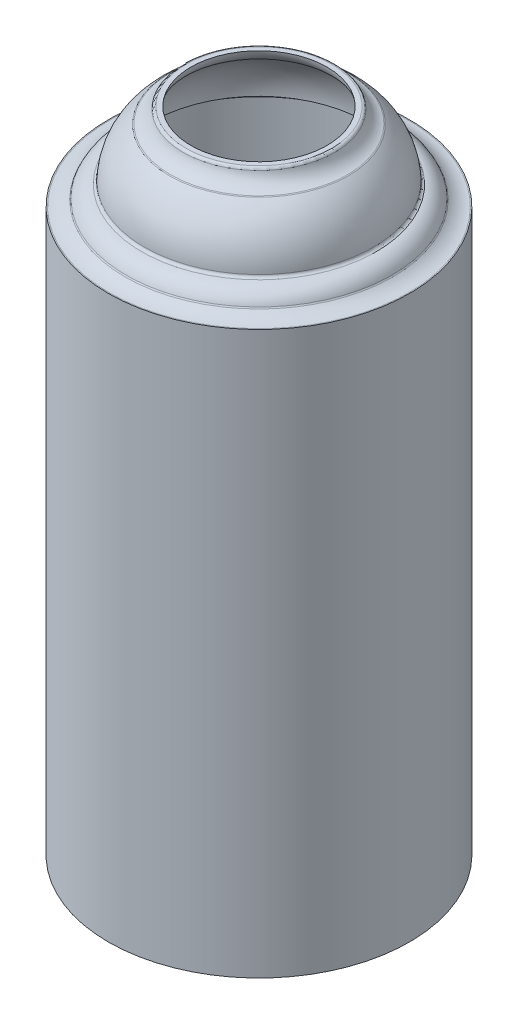
from build123d import *

# Parameters (mm, degrees)
SKETCH1_R           = 66.04
SKETCH1_R_2         = 64.4525
BOSS_EXTRUDE1_DEPTH = 246.38
FILLET3_R           = 1.27


with BuildPart() as part:
    # Sketch1 → Boss-Extrude1 (new body)
    with BuildSketch(Plane(origin=(0, 0, 0), x_dir=(1, 0, 0), z_dir=(0, 1, 0))):
        with Locations(Location((0, 0, 0), (0, 0, 270))):
            Circle(SKETCH1_R)
        with Locations(Location((0, 0, 0), (0, 0, 270))):
            Circle(SKETCH1_R_2, mode=Mode.SUBTRACT)
    extrude(amount=BOSS_EXTRUDE1_DEPTH)

    # Sketch4 → Revolve5 (revolve)
    with BuildSketch(Plane.XY, mode=Mode.PRIVATE) as revolve5_sk:
        with BuildLine():
            ThreePointArc((-50.313730209, 254.962138497), (-55.29308505, 253.369930369), (-58.424842289, 249.184097363))
            ThreePointArc((-58.424842289, 249.184097363), (-61.96758374, 247.062823084), (-66.04, 246.38))
            Line((-66.04, 246.38), (0, 246.38))
            Line((0, 246.38), (0, 284.48))
            Line((0, 284.48), (-33.02, 284.48))
            ThreePointArc((-33.02, 284.48), (-34.99100046, 280.215897021), (-39.01155126, 277.786372726))
            ThreePointArc((-39.01155126, 277.786372726), (-47.333429049, 267.696785304), (-50.313730209, 254.962138497))
        make_face()
    revolve(revolve5_sk.sketch.rotate(Axis((0, 246.38, 0), (0, 1, 0)), 270), axis=Axis((0, 246.38, 0), (0, 1, 0)))

    # Fillet3
    fillet3_edges = [part.edges().sort_by_distance(p)[0] for p in [
        (0, 246.38, 65.582447768),
        (0, 254.962138497, 50.313730209),
        (0, 249.184097363, 58.424842289),
        (0, 284.48, 33.02),
        (0, 277.786372726, 39.01155126),
    ]]
    fillet(fillet3_edges, radius=FILLET3_R)

    # Sketch7 → Revolve8 (revolve)
    with BuildSketch(Plane(origin=(0, 0, 0), x_dir=(0, 0, -1), z_dir=(1, 0, 0))):
        with BuildLine():
            ThreePointArc((-66.04, 3.175), (-34.293967325, 16.978033309), (0, 21.695884959))
            Line((0, 21.695884959), (0, 18.520884959))
            ThreePointArc((0, 18.520884959), (-34.293967325, 13.803033309), (-66.04, 0))
            Line((-66.04, 0), (-66.04, 3.175))
        make_face()
    revolve(axis=Axis((0, 0, 0), (0, 1, 0)))

    # Sketch10 → Cut-Revolve1 (revolve, cut)
    with BuildSketch(Plane.XY, mode=Mode.PRIVATE) as cut_revolve1_sk:
        with BuildLine():
            Line((-60.092086221, 246.38), (0, 246.38))
            Line((0, 246.38), (0, 284.48))
            Line((0, 284.48), (-29.845, 284.48))
            ThreePointArc((-29.845, 284.48), (-31.81600046, 280.215897021), (-35.83655126, 277.786372726))
            ThreePointArc((-35.83655126, 277.786372726), (-44.158429049, 267.696785304), (-47.138730209, 254.962138497))
            ThreePointArc((-47.138730209, 254.962138497), (-52.11808505, 253.369930369), (-55.249842289, 249.184097363))
            ThreePointArc((-55.249842289, 249.184097363), (-57.49176142, 247.472593008), (-60.092086221, 246.38))
        make_face()
    revolve(cut_revolve1_sk.sketch.rotate(Axis((0, 246.38, 0), (0, 1, 0)), 270), axis=Axis((0, 246.38, 0), (0, 1, 0)), mode=Mode.SUBTRACT)


solid = part.part
